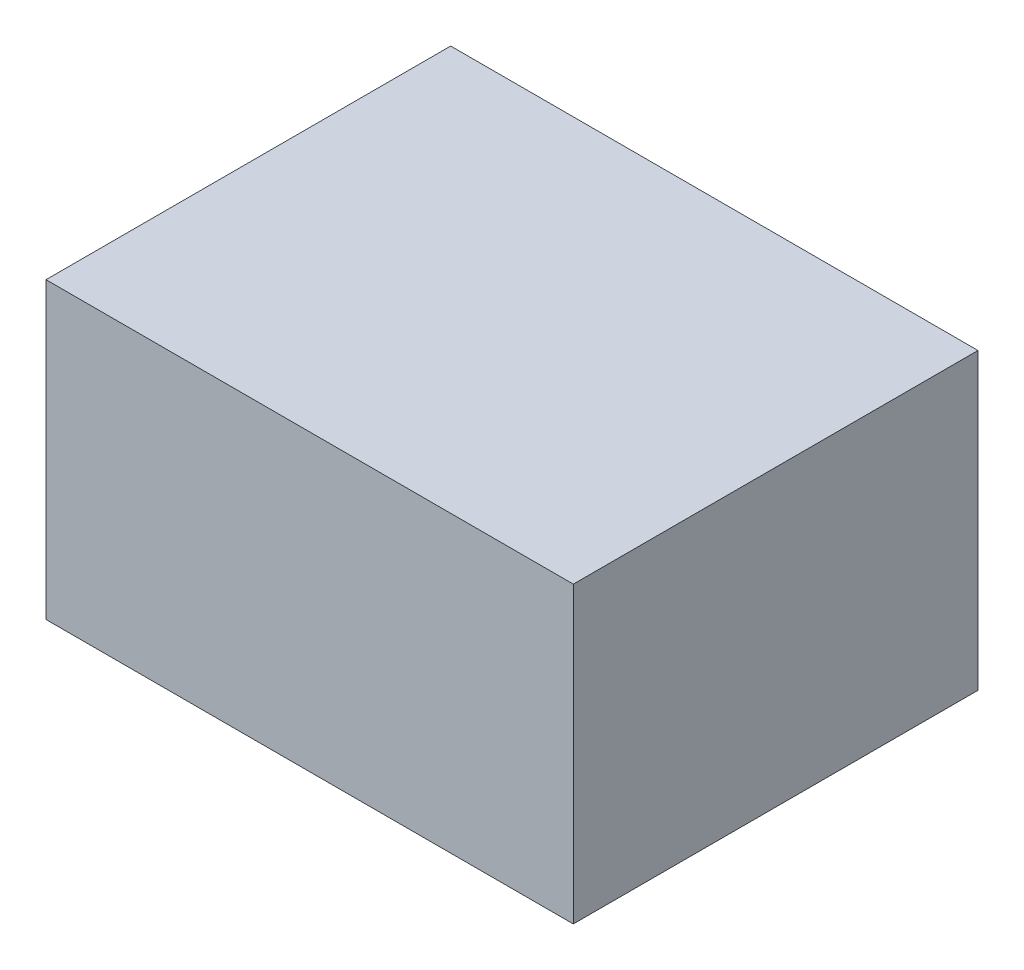
from build123d import *

# Parameters (mm, degrees)
CASE_START    = 68.57
CASE_SKETCH_W = 43
CASE_SKETCH_H = 33
CASE_2_DEPTH  = 24


with BuildPart() as part:
    # Case Sketch → Case 2 (new body)
    with BuildSketch(Plane(origin=(0, 0, 0), x_dir=(1, 0, 0), z_dir=(0, 1, 0)).offset(CASE_START)):
        Rectangle(CASE_SKETCH_W, CASE_SKETCH_H)
    extrude(amount=CASE_2_DEPTH)


solid = part.part
